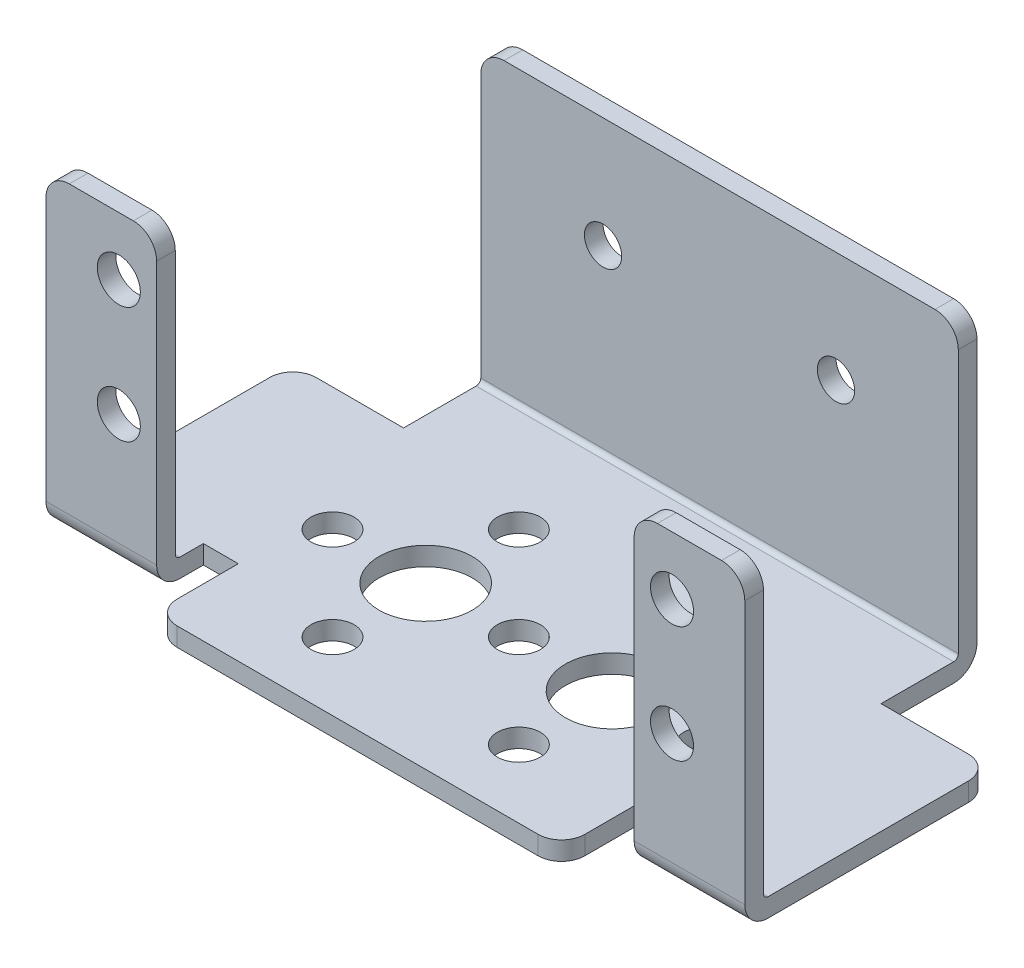
from build123d import *

# Parameters (mm, degrees)
EXTRUDE1_DEPTH             = 1.6
SKETCH2_W                  = 9.5
SKETCH2_H                  = 1.6
SKETCH2_W_2                = 41
EXTRUDE2_DEPTH             = 25
FILLET2_R                  = 0.4
FILLET3_R                  = 2
F_3_7_3_7_DIAMETER_HOLE1_D = 3.7
SKETCH4_R                  = 1.6
CUT_EXTRUDE2_DEPTH         = 51.723546025
SKETCH5_R                  = 4
CUT_EXTRUDE3_DEPTH         = 44.354296563
SKETCH5_3_R                = 1.85
CUT_EXTRUDE4_DEPTH         = 44.354296563
CIRPATTERN1_COUNT          = 4
SKETCH5_4_R                = 1.85
CUT_EXTRUDE5_DEPTH         = 10
CIRPATTERN2_COUNT          = 4


with BuildPart() as part:
    # Sketch1 → Extrude1 (new body)
    with BuildSketch(Plane(origin=(0, 0, 0), x_dir=(1, 0, 0), z_dir=(0, 1, 0))):
        Polygon((-30, -10.6), (-30, 10.6), (-20.5, 10.6), (-20.5, 18.83069384), (20.5, 18.83069384), (20.5, 10.6), (30, 10.6), (30, -10.6), (20.5, -10.6), (20.5, -6.588025881), (17.5, -6.588025881), (17.5, -13.838875216), (-17.5, -13.838875216), (-17.5, -6.588025881), (-20.5, -6.588025881), (-20.5, -10.6), align=None)
    extrude(amount=EXTRUDE1_DEPTH)

    # Sketch2 → Extrude2 (add)
    with BuildSketch(Plane(origin=(0, 1.6, 0), x_dir=(1, 0, 0), z_dir=(0, 1, 0))):
        with Locations((-25.25, -9.8)):
            Rectangle(SKETCH2_W, SKETCH2_H)
        with Locations((25.25, -9.8)):
            Rectangle(SKETCH2_W, SKETCH2_H)
        with Locations((0, 18.03069384)):
            Rectangle(SKETCH2_W_2, SKETCH2_H)
    extrude(amount=EXTRUDE2_DEPTH)

    # Fillet2
    fillet2_edges = [part.edges().sort_by_distance(p)[0] for p in [
        (-25.25, 1.6, 9),
        (25.25, 1.6, 9),
        (0, 1.6, -17.23069384),
    ]]
    fillet(fillet2_edges, radius=FILLET2_R)

    # Fillet3
    fillet3_edges = [part.edges().sort_by_distance(p)[0] for p in [
        (-30, 0.8, -10.6),
        (-17.5, 0.8, 13.838875216),
        (30, 0.8, -10.6),
        (20.5, 26.6, 9.8),
        (30, 26.6, 9.8),
        (20.5, 26.6, -18.03069384),
        (-20.5, 26.6, -18.03069384),
        (-30, 26.6, 9.8),
        (-20.5, 26.6, 9.8),
        (-25.25, 0, 10.6),
        (25.25, 0, 10.6),
        (0, 0, -18.83069384),
        (17.5, 0.8, 13.838875216),
    ]]
    fillet(fillet3_edges, radius=FILLET3_R)

    # Ø3.7 (3.7) Diameter Hole1 (through all)
    with Locations(Plane.XY.offset(10.6)):
        with Locations((-23.75, 21.6), (-23.75, 11.6), (23.75, 11.6), (23.75, 21.6)):
            Hole(F_3_7_3_7_DIAMETER_HOLE1_D / 2)

    # Sketch4 → Cut-Extrude2 (cut, through all)
    with BuildSketch(Plane.XY.offset(-17.23069384)):
        with Locations((10, 17.09445923)):
            Circle(SKETCH4_R)
        with Locations((-10, 17.09445923)):
            Circle(SKETCH4_R)
    extrude(amount=-CUT_EXTRUDE2_DEPTH, mode=Mode.SUBTRACT)

    # Sketch5 → Cut-Extrude3 (cut, through all)
    with BuildSketch(Plane(origin=(0, 1.6, 0), x_dir=(1, 0, 0), z_dir=(0, 1, 0))):
        with Locations((8, 0)):
            Circle(SKETCH5_R)
        with Locations((-8, 0)):
            Circle(SKETCH5_R)
    extrude(amount=-CUT_EXTRUDE3_DEPTH, mode=Mode.SUBTRACT)

    # Sketch5<3> → Cut-Extrude4 (cut, through all)
    with BuildSketch(Plane(origin=(0, 1.6, 0), x_dir=(1, 0, 0), z_dir=(0, 1, 0))):
        with Locations((8, 8)):
            Circle(SKETCH5_3_R)
    cut_extrude4 = extrude(amount=-CUT_EXTRUDE4_DEPTH, mode=Mode.SUBTRACT)

    # CirPattern1: Cut-Extrude4 ×4 about axis
    cirpattern1_axis = Axis((8, 0, 0), (0, 1, 0))
    for i in range(1, CIRPATTERN1_COUNT):
        add(cut_extrude4.rotate(cirpattern1_axis, i * 360 / CIRPATTERN1_COUNT), mode=Mode.SUBTRACT)

    # Sketch5<4> → Cut-Extrude5 (cut)
    with BuildSketch(Plane(origin=(0, 1.6, 0), x_dir=(1, 0, 0), z_dir=(0, 1, 0))):
        with Locations((-8, 8)):
            Circle(SKETCH5_4_R)
    cut_extrude5 = extrude(amount=-CUT_EXTRUDE5_DEPTH, mode=Mode.SUBTRACT)

    # CirPattern2: Cut-Extrude5 ×4 about axis
    cirpattern2_axis = Axis((-8, 0, 0), (0, 1, 0))
    for i in range(1, CIRPATTERN2_COUNT):
        add(cut_extrude5.rotate(cirpattern2_axis, i * 360 / CIRPATTERN2_COUNT), mode=Mode.SUBTRACT)


solid = part.part
